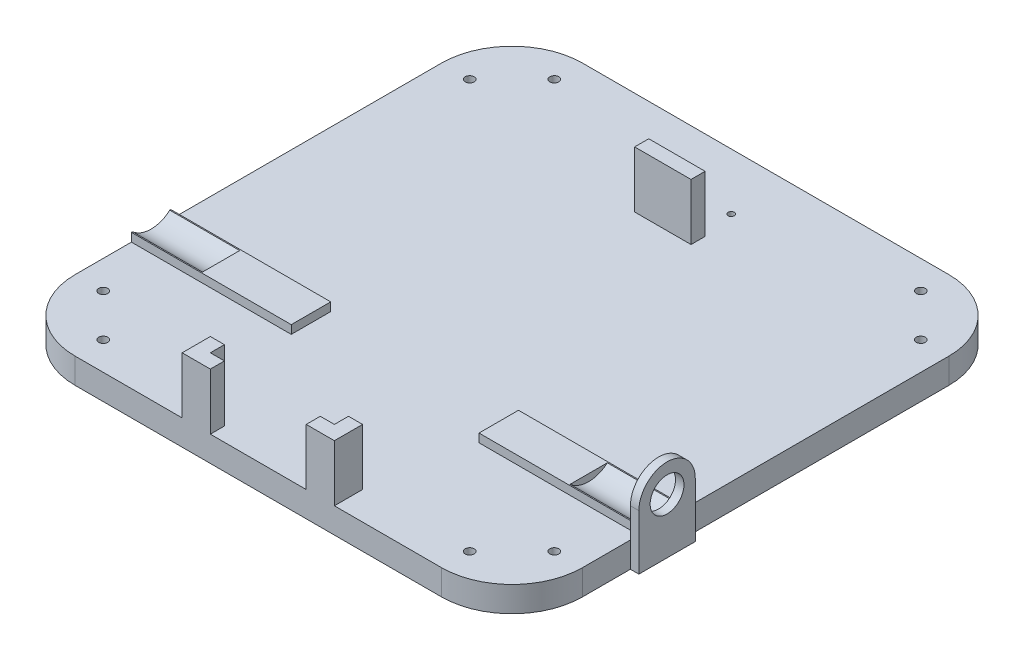
from build123d import *

# Parameters (mm, degrees)
PLATE_DEPTH         = 9
SKETCH2_R           = 1.09
CASTER_HOLES_DEPTH  = 128.597021909
SKETCH3_R           = 1.6
HEX_HOLES_DEPTH     = 128.597021909
SKETCH4_W           = 20
SKETCH4_H           = 5
BOSS_EXTRUDE1_DEPTH = 20
SKETCH5_W           = 56.7
SKETCH5_H           = 14
BOSS_EXTRUDE2_DEPTH = 3
SKETCH6_R           = 10
CUT_EXTRUDE1_DEPTH  = 24.8
CUT_EXTRUDE2_START  = -24.8
SKETCH7_R           = 10
CUT_EXTRUDE2_DEPTH  = 24.8
SKETCH8_R           = 6
BOSS_EXTRUDE4_DEPTH = 3


with BuildPart() as part:
    # Sketch1 → Plate (new body)
    with BuildSketch(Plane(origin=(0, 0, 0), x_dir=(1, 0, 0), z_dir=(0, 1, 0))):
        with BuildLine():
            Line((-65, -90), (65, -90))
            ThreePointArc((65, -90), (82.67766953, -82.67766953), (90, -65))
            Line((90, -65), (90, 65))
            ThreePointArc((90, 65), (82.67766953, 82.67766953), (65, 90))
            Line((65, 90), (-65, 90))
            ThreePointArc((-65, 90), (-82.67766953, 82.67766953), (-90, 65))
            Line((-90, 65), (-90, -65))
            ThreePointArc((-90, -65), (-82.67766953, -82.67766953), (-65, -90))
        make_face()
    extrude(amount=PLATE_DEPTH)

    # Sketch2 → Caster Holes (cut, through all)
    with BuildSketch(Plane(origin=(0, 9, 0), x_dir=(1, 0, 0), z_dir=(0, 1, 0))):
        with Locations(Location((-7.747, 70, 0), (0, 0, 270))):
            Circle(SKETCH2_R)
        with Locations(Location((7.747, 70, 0), (0, 0, 270))):
            Circle(SKETCH2_R)
    extrude(amount=-CASTER_HOLES_DEPTH, mode=Mode.SUBTRACT)

    # Sketch3 → Hex Holes (cut, through all)
    with BuildSketch(Plane(origin=(0, 9, 0), x_dir=(1, 0, 0), z_dir=(0, 1, 0))):
        with Locations(Location((-65, 80, 0), (0, 0, 270))):
            Circle(SKETCH3_R)
        with Locations(Location((-80, 65, 0), (0, 0, 270))):
            Circle(SKETCH3_R)
        with Locations(Location((80, 65, 0), (0, 0, 270))):
            Circle(SKETCH3_R)
        with Locations(Location((80, -65, 0), (0, 0, 270))):
            Circle(SKETCH3_R)
        with Locations(Location((65, 80, 0), (0, 0, 270))):
            Circle(SKETCH3_R)
        with Locations(Location((65, -80, 0), (0, 0, 270))):
            Circle(SKETCH3_R)
        with Locations(Location((-65, -80, 0), (0, 0, 270))):
            Circle(SKETCH3_R)
        with Locations(Location((-80, -65, 0), (0, 0, 270))):
            Circle(SKETCH3_R)
    extrude(amount=-HEX_HOLES_DEPTH, mode=Mode.SUBTRACT)

    # Sketch4 → Boss-Extrude1 (add)
    with BuildSketch(Plane(origin=(0, 9, 0), x_dir=(1, 0, 0), z_dir=(0, 1, 0))):
        Polygon((-27, -90), (-27, -80), (-22, -80), (-22, -85), (-17, -85), (-17, -90), align=None)
        Polygon((17, -90), (17, -85), (22, -85), (22, -80), (27, -80), (27, -90), align=None)
        with Locations((0, 56)):
            Rectangle(SKETCH4_W, SKETCH4_H)
    extrude(amount=BOSS_EXTRUDE1_DEPTH)

    # Sketch5 → Boss-Extrude2 (add)
    with BuildSketch(Plane(origin=(0, 9, 0), x_dir=(1, 0, 0), z_dir=(0, 1, 0))):
        with Locations((-61.65, -38)):
            Rectangle(SKETCH5_W, SKETCH5_H)
        with Locations((61.65, -38)):
            Rectangle(SKETCH5_W, SKETCH5_H)
    extrude(amount=BOSS_EXTRUDE2_DEPTH)

    # Sketch6 → Cut-Extrude1 (cut)
    with BuildSketch(Plane.ZY.offset(90)):
        with Locations((38, 19.5)):
            Circle(SKETCH6_R)
    extrude(amount=-CUT_EXTRUDE1_DEPTH, mode=Mode.SUBTRACT)

    # Sketch7 → Cut-Extrude2 (cut)
    with BuildSketch(Plane(origin=(90, 0, 0), x_dir=(0, 0, -1), z_dir=(1, 0, 0)).offset(CUT_EXTRUDE2_START)):
        with Locations((-38, 19.5)):
            Circle(SKETCH7_R)
    extrude(amount=CUT_EXTRUDE2_DEPTH, mode=Mode.SUBTRACT)

    # Sketch8 → Boss-Extrude4 (add)
    with BuildSketch(Plane(origin=(90, 0, 0), x_dir=(0, 0, -1), z_dir=(1, 0, 0))):
        with BuildLine():
            Line((-48, 19.5), (-48, 0))
            Line((-48, 0), (-28, 0))
            Line((-28, 0), (-28, 19.5))
            ThreePointArc((-28, 19.5), (-38, 29.5), (-48, 19.5))
        make_face()
        with Locations((-38, 19.5)):
            Circle(SKETCH8_R, mode=Mode.SUBTRACT)
    extrude(amount=BOSS_EXTRUDE4_DEPTH)


solid = part.part
